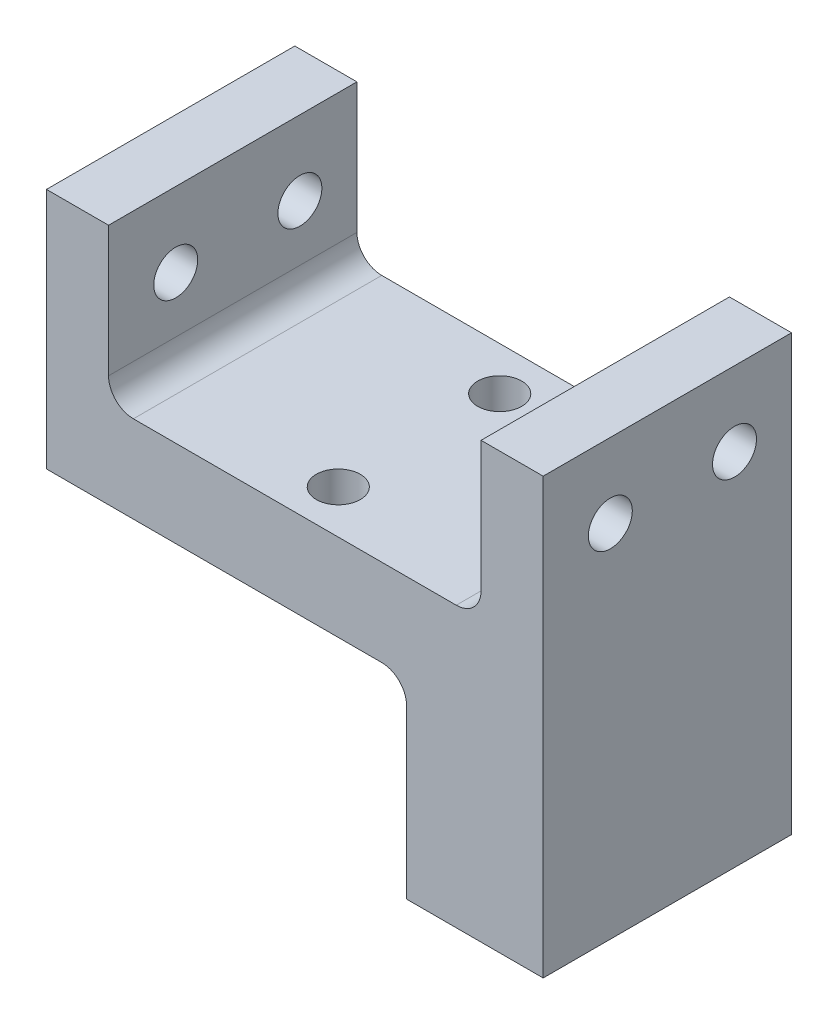
from build123d import *

# Parameters (mm, degrees)
SKETCH1_W                    = 50.8
SKETCH1_H                    = 25.4
BOSS_EXTRUDE1_DEPTH          = 44.45
SKETCH8_W                    = 13.97
SKETCH8_H                    = 19.685
SKETCH8_W_2                  = 22.86
SKETCH8_W_3                  = 38.1
SKETCH8_H_2                  = 15.875
CUT_EXTRUDE1_DEPTH           = 58.15
F_8_CLEARANCE_HOLE3_D        = 4.4958
F_8_CLEARANCE_HOLE2_D        = 4.4958
F_1_8_0_18_DOWEL_HOLE1_D     = 4.572
F_1_8_0_18_DOWEL_HOLE1_DEPTH = 7.62
F_1_8_0_18_DOWEL_HOLE1_TIP   = 1.373567375
FILLET1_R                    = 2.54
SKETCH17_R                   = 1.27
CUT_EXTRUDE3_DEPTH           = 12.7


with BuildPart() as part:
    # Sketch1 → Boss-Extrude1 (new body)
    with BuildSketch(Plane(origin=(0, 0, 0), x_dir=(1, 0, 0), z_dir=(0, 1, 0))):
        Rectangle(SKETCH1_W, SKETCH1_H)
    extrude(amount=BOSS_EXTRUDE1_DEPTH)

    # Sketch8 → Cut-Extrude1 (cut, through all)
    with BuildSketch(Plane.XY.offset(12.7)):
        with Locations((-18.415, 9.8425)):
            Rectangle(SKETCH8_W, SKETCH8_H)
        with Locations((0, 9.8425)):
            Rectangle(SKETCH8_W_2, SKETCH8_H)
        with Locations((0, 36.5125)):
            Rectangle(SKETCH8_W_3, SKETCH8_H_2)
    extrude(amount=-CUT_EXTRUDE1_DEPTH, mode=Mode.SUBTRACT)

    # #8 Clearance Hole3 (through all)
    with Locations(Plane(origin=(25.4, 0, 0), x_dir=(0, 0, -1), z_dir=(1, 0, 0))):
        with Locations((6.868185943, 36.83), (-5.831814057, 36.83)):
            Hole(F_8_CLEARANCE_HOLE3_D / 2)

    # #8 Clearance Hole2 (through all)
    with Locations(Plane(origin=(0, 28.575, 0), x_dir=(1, 0, 0), z_dir=(0, 1, 0))):
        with Locations((0, 8.255), (0, -8.255)):
            Hole(F_8_CLEARANCE_HOLE2_D / 2)

    # 1/8 (0.18) Dowel Hole1
    with Locations(Plane.ZY.offset(-11.43)):
        with Locations((2.916276039, 6.096)):
            Hole(F_1_8_0_18_DOWEL_HOLE1_D / 2, depth=F_1_8_0_18_DOWEL_HOLE1_DEPTH)
            with Locations((0, 0, -(F_1_8_0_18_DOWEL_HOLE1_DEPTH + F_1_8_0_18_DOWEL_HOLE1_TIP / 2))):  # 118° drill point
                Cone(0, F_1_8_0_18_DOWEL_HOLE1_D / 2, F_1_8_0_18_DOWEL_HOLE1_TIP, mode=Mode.SUBTRACT)

    # Fillet1
    fillet1_edges = [part.edges().sort_by_distance(p)[0] for p in [
        (11.43, 19.685, 0),
        (19.05, 28.575, 0),
        (-19.05, 28.575, 0),
    ]]
    fillet(fillet1_edges, radius=FILLET1_R)

    # Sketch17 → Cut-Extrude3 (cut)
    with BuildSketch(Plane.XY.offset(-12.7)):
        with Locations((-22.225, 27.508501284)):
            Circle(SKETCH17_R)
        with Locations((22.225, 27.508501284)):
            Circle(SKETCH17_R)
    extrude(amount=CUT_EXTRUDE3_DEPTH, mode=Mode.SUBTRACT)


solid = part.part
